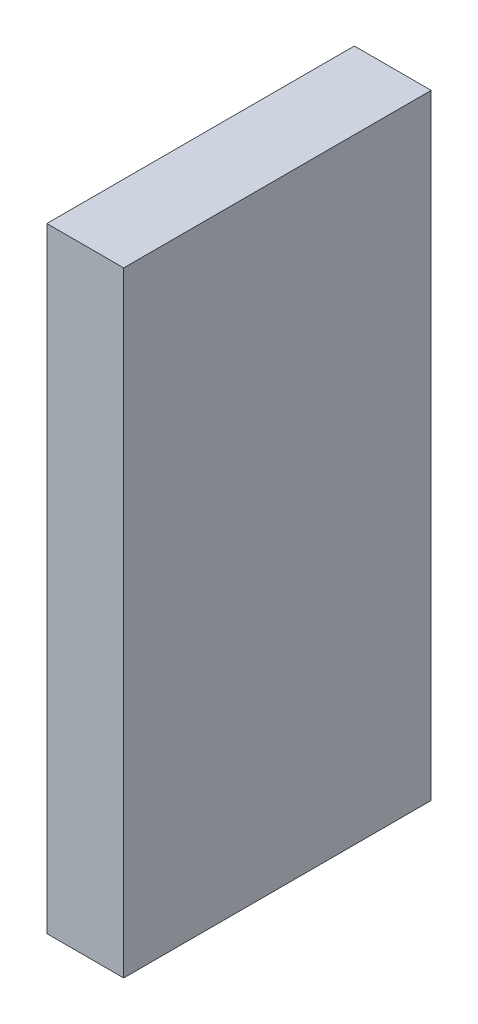
from build123d import *

# Parameters (mm, degrees)
SKETCH1_W           = 25.4
SKETCH1_H           = 50.8
BOSS_EXTRUDE1_DEPTH = 3.175


with BuildPart() as part:
    # Sketch1 → Boss-Extrude1 (new, symmetric)
    with BuildSketch(Plane(origin=(0, 0, 0), x_dir=(0, 0, -1), z_dir=(1, 0, 0))):
        Rectangle(SKETCH1_W, SKETCH1_H)
    extrude(amount=BOSS_EXTRUDE1_DEPTH, both=True)


solid = part.part
